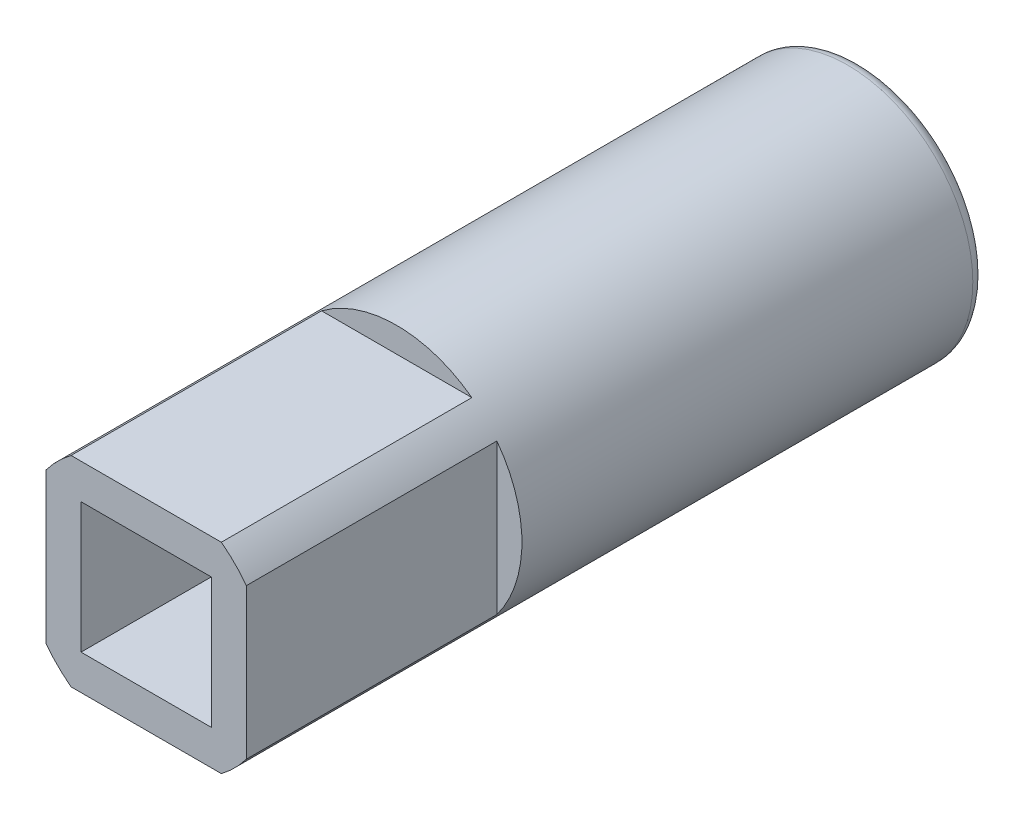
from build123d import *

# Parameters (mm, degrees)
SKETCH1_R           = 5
BOSS_EXTRUDE1_DEPTH = 18.5
BOSS_EXTRUDE2_DEPTH = 10
SKETCH4_W           = 5.2
SKETCH4_H           = 5.2
CUT_EXTRUDE2_DEPTH  = 10
FILLET1_R           = 0.5


with BuildPart() as part:
    # Sketch1 → Boss-Extrude1 (new body)
    with BuildSketch(Plane.XY):
        Circle(SKETCH1_R)
    extrude(amount=BOSS_EXTRUDE1_DEPTH)

    # Sketch3 → Boss-Extrude2 (add)
    with BuildSketch(Plane.XY.offset(18.5)):
        with BuildLine():
            ThreePointArc((-4, -3), (-3.535533906, -3.535533906), (-3, -4))
            Line((-3, -4), (3, -4))
            ThreePointArc((3, -4), (3.535533906, -3.535533906), (4, -3))
            Line((4, -3), (4, 3))
            ThreePointArc((4, 3), (3.535533906, 3.535533906), (3, 4))
            Line((3, 4), (-3, 4))
            ThreePointArc((-3, 4), (-3.535533906, 3.535533906), (-4, 3))
            Line((-4, 3), (-4, -3))
        make_face()
    extrude(amount=BOSS_EXTRUDE2_DEPTH)

    # Sketch4 → Cut-Extrude2 (cut)
    with BuildSketch(Plane.XY.offset(28.5)):
        Rectangle(SKETCH4_W, SKETCH4_H)
    extrude(amount=-CUT_EXTRUDE2_DEPTH, mode=Mode.SUBTRACT)

    # Fillet1
    fillet1_edges = [part.edges().sort_by_distance(p)[0] for p in [
        (-5, 0, 0),
    ]]
    fillet(fillet1_edges, radius=FILLET1_R)


solid = part.part
